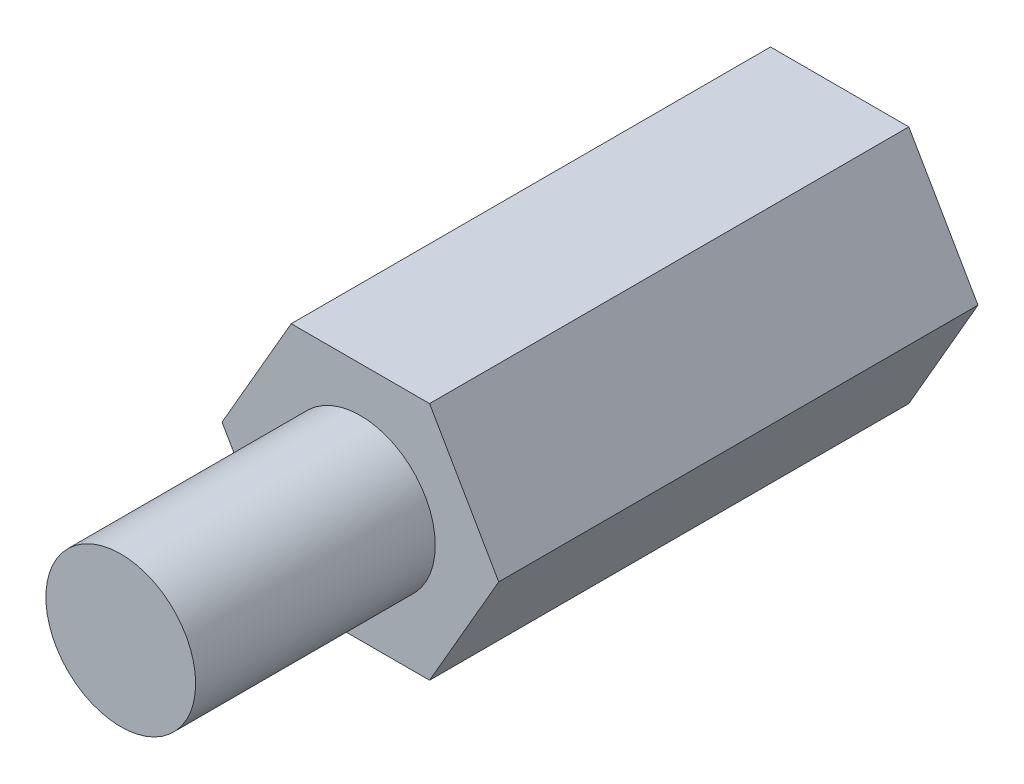
from build123d import *

# Parameters (mm, degrees)
BOSS_EXTRUDE1_DEPTH     = 8
SKETCH2_R               = 1.25
BOSS_EXTRUDE2_DEPTH     = 4
M2_5_TAPPED_HOLE1_D     = 2.05
M2_5_TAPPED_HOLE1_DEPTH = 5.5
M2_5_TAPPED_HOLE1_TIP   = 0.615882135


with BuildPart() as part:
    # Sketch1 → Boss-Extrude1 (new body)
    with BuildSketch(Plane.XY):
        Polygon((-1.154700538, -2), (1.154700538, -2), (2.309401077, 0), (1.154700538, 2), (-1.154700538, 2), (-2.309401077, 0), align=None)
    extrude(amount=BOSS_EXTRUDE1_DEPTH)

    # Sketch2 → Boss-Extrude2 (add)
    with BuildSketch(Plane.XY.offset(8)):
        Circle(SKETCH2_R)
    extrude(amount=BOSS_EXTRUDE2_DEPTH)

    # M2.5 Tapped Hole1
    with Locations(Plane(origin=(0, 0, 0), x_dir=(-1, 0, 0), z_dir=(0, 0, -1))):
        with Locations((0, 0)):
            Hole(M2_5_TAPPED_HOLE1_D / 2, depth=M2_5_TAPPED_HOLE1_DEPTH)
            with Locations((0, 0, -(M2_5_TAPPED_HOLE1_DEPTH + M2_5_TAPPED_HOLE1_TIP / 2))):  # 118° drill point
                Cone(0, M2_5_TAPPED_HOLE1_D / 2, M2_5_TAPPED_HOLE1_TIP, mode=Mode.SUBTRACT)


solid = part.part
